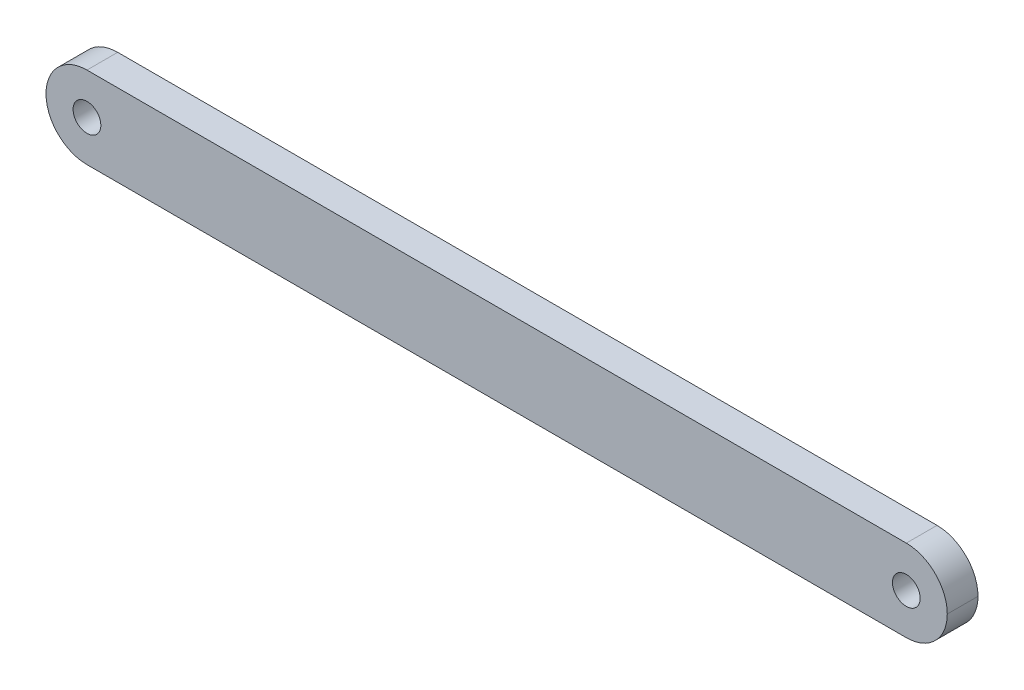
from build123d import *

# Parameters (mm, degrees)
SKETCH_1_R      = 1.354010502
EXTRUDE_1_DEPTH = 3


with BuildPart() as part:
    # 草图1 → 凸台-拉伸1 (new body)
    with BuildSketch(Plane(origin=(0, 0, 0), x_dir=(-1, 0, 0), z_dir=(0, 0, -1))):
        with BuildLine():
            Line((-55.860221974, 0), (24.13832066, 0))
            ThreePointArc((24.13832066, 0), (26.966394209, 1.171219344), (28.138320535, 3.999))
            ThreePointArc((28.138320535, 3.999), (26.96674766, 6.827427125), (24.138320535, 7.999))
            Line((24.138320535, 7.999), (-55.860222099, 7.999))
            ThreePointArc((-55.860222099, 7.999), (-58.688295648, 6.827780656), (-59.860221974, 4))
            ThreePointArc((-59.860221974, 4), (-58.688649099, 1.171572875), (-55.860221974, 0))
        make_face()
        with Locations((24.138809001, 3.998511534)):
            Circle(SKETCH_1_R, mode=Mode.SUBTRACT)
        with Locations((-55.859733508, 3.999511534)):
            Circle(SKETCH_1_R, mode=Mode.SUBTRACT)
    extrude(amount=-EXTRUDE_1_DEPTH)


solid = part.part
